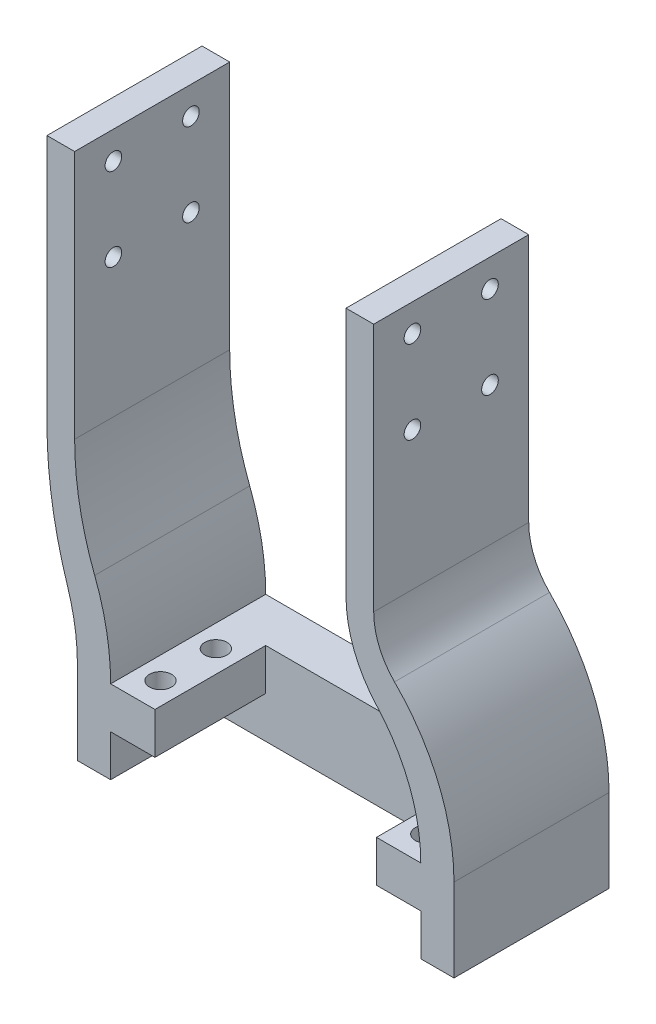
from build123d import *

# Parameters (mm, degrees)
SKETCH1_W           = 8
SKETCH1_H           = 8
SKETCH1_W_2         = 40
BOSS_EXTRUDE1_DEPTH = 15
SKETCH1_5_W         = 8
SKETCH1_5_H         = 20
SKETCH1_5_R         = 2
BOSS_EXTRUDE2_DEPTH = 7.5
BOSS_EXTRUDE3_DEPTH = 28
CUT_EXTRUDE1_REACH  = 105.271
SKETCH3_R           = 1.5


with BuildPart() as part:
    # Sketch1 → Boss-Extrude1 (new body)
    with BuildSketch(Plane(origin=(0, 0, 0), x_dir=(1, 0, 0), z_dir=(0, 1, 0))):
        Polygon((6, -28), (6, -8), (6, 0), (0, 0), (0, -28), align=None)
        with Locations((10, -4)):
            Rectangle(SKETCH1_W, SKETCH1_H)
        with Locations((34, -4)):
            Rectangle(SKETCH1_W_2, SKETCH1_H)
        with Locations((58, -4)):
            Rectangle(SKETCH1_W, SKETCH1_H)
        Polygon((62, 0), (62, -8), (62, -28), (68, -28), (68, 0), align=None)
    extrude(amount=-BOSS_EXTRUDE1_DEPTH)

    # Sketch1<5> → Boss-Extrude2 (add)
    # profile 1 of 2: a face of its own
    with BuildSketch(Plane(origin=(0, 0, 0), x_dir=(1, 0, 0), z_dir=(0, 1, 0))):
        with Locations((10, -18)):
            Rectangle(SKETCH1_5_W, SKETCH1_5_H)
        with Locations(Location((10, -23, 0), (0, 0, 270))):
            Circle(SKETCH1_5_R, mode=Mode.SUBTRACT)
        with Locations(Location((10, -13, 0), (0, 0, 270))):
            Circle(SKETCH1_5_R, mode=Mode.SUBTRACT)
    # profile 2 of 2: a face of its own
    with BuildSketch(Plane(origin=(0, 0, 0), x_dir=(1, 0, 0), z_dir=(0, 1, 0))):
        with Locations((58, -18)):
            Rectangle(SKETCH1_5_W, SKETCH1_5_H)
        with Locations(Location((58, -23, 0), (0, 0, 270))):
            Circle(SKETCH1_5_R, mode=Mode.SUBTRACT)
        with Locations(Location((58, -13, 0), (0, 0, 270))):
            Circle(SKETCH1_5_R, mode=Mode.SUBTRACT)
    extrude(amount=-BOSS_EXTRUDE2_DEPTH)

    # Sketch2 → Boss-Extrude3 (add)
    with BuildSketch(Plane.XY.offset(28)):
        with BuildLine():
            Line((-0.5, 80), (-5.5, 80))
            Line((-5.5, 80), (-5.5, 35))
            ThreePointArc((-5.5, 35), (-4.567837418, 23.063317904), (-1.793950653, 11.416049609))
            ThreePointArc((-1.793950653, 11.416049609), (-0.451222721, 5.778071643), (0, 0))
            Line((0, 0), (6, 0))
            ThreePointArc((6, 0), (5.273404236, 7.891775129), (3.118046932, 15.51820883))
            ThreePointArc((3.118046932, 15.51820883), (0.412179175, 25.092547618), (-0.5, 35))
            Line((-0.5, 35), (-0.5, 80))
        make_face()
        with BuildLine():
            Line((53.5, 80), (48.5, 80))
            Line((48.5, 80), (48.5, 35))
            ThreePointArc((48.5, 35), (49.937115956, 27.280735927), (54.055895054, 20.595827638))
            ThreePointArc((54.055895054, 20.595827638), (59.945137576, 11.037401409), (62, 0))
            Line((62, 0), (68, 0))
            ThreePointArc((68, 0), (65.207771721, 14.035220845), (57.256309947, 25.933044956))
            ThreePointArc((57.256309947, 25.933044956), (54.476245108, 30.092874105), (53.5, 35))
            Line((53.5, 35), (53.5, 80))
        make_face()
    extrude(amount=-BOSS_EXTRUDE3_DEPTH)

    # Cut-Extrude1: up to this face of the body (flat: up to its plane)
    cut_extrude1_end = Plane(part.part.faces().sort_by_distance((-5.5, 57.5, 14))[0])
    # Sketch3 → Cut-Extrude1 (cut, up to the picked face)
    with BuildSketch(Plane(origin=(53.5, 0, 0), x_dir=(0, 0, -1), z_dir=(1, 0, 0)), mode=Mode.PRIVATE) as cut_extrude1_sk1:
        with Locations(Location((-21, 75, 0), (0, 0, 90))):
            Circle(SKETCH3_R)
    cut_extrude1_tool1 = split(extrude(cut_extrude1_sk1.sketch, amount=-CUT_EXTRUDE1_REACH, mode=Mode.PRIVATE), bisect_by=cut_extrude1_end, keep=Keep.BOTH, mode=Mode.PRIVATE)
    # Sketch3 → Cut-Extrude1 (cut, up to the picked face)
    with BuildSketch(Plane(origin=(53.5, 0, 0), x_dir=(0, 0, -1), z_dir=(1, 0, 0)), mode=Mode.PRIVATE) as cut_extrude1_sk2:
        with Locations(Location((-21, 60, 0), (0, 0, 90))):
            Circle(SKETCH3_R)
    cut_extrude1_tool2 = split(extrude(cut_extrude1_sk2.sketch, amount=-CUT_EXTRUDE1_REACH, mode=Mode.PRIVATE), bisect_by=cut_extrude1_end, keep=Keep.BOTH, mode=Mode.PRIVATE)
    # Sketch3 → Cut-Extrude1 (cut, up to the picked face)
    with BuildSketch(Plane(origin=(53.5, 0, 0), x_dir=(0, 0, -1), z_dir=(1, 0, 0)), mode=Mode.PRIVATE) as cut_extrude1_sk3:
        with Locations(Location((-7, 60, 0), (0, 0, 180))):
            Circle(SKETCH3_R)
    cut_extrude1_tool3 = split(extrude(cut_extrude1_sk3.sketch, amount=-CUT_EXTRUDE1_REACH, mode=Mode.PRIVATE), bisect_by=cut_extrude1_end, keep=Keep.BOTH, mode=Mode.PRIVATE)
    # Sketch3 → Cut-Extrude1 (cut, up to the picked face)
    with BuildSketch(Plane(origin=(53.5, 0, 0), x_dir=(0, 0, -1), z_dir=(1, 0, 0)), mode=Mode.PRIVATE) as cut_extrude1_sk4:
        with Locations(Location((-7, 75, 0), (0, 0, 180))):
            Circle(SKETCH3_R)
    cut_extrude1_tool4 = split(extrude(cut_extrude1_sk4.sketch, amount=-CUT_EXTRUDE1_REACH, mode=Mode.PRIVATE), bisect_by=cut_extrude1_end, keep=Keep.BOTH, mode=Mode.PRIVATE)
    add(cut_extrude1_tool1.solids().sort_by(Axis((53.5, 75, 21), (-1, 0, 0)))[0], mode=Mode.SUBTRACT)
    add(cut_extrude1_tool2.solids().sort_by(Axis((53.5, 60, 21), (-1, 0, 0)))[0], mode=Mode.SUBTRACT)
    add(cut_extrude1_tool3.solids().sort_by(Axis((53.5, 60, 7), (-1, 0, 0)))[0], mode=Mode.SUBTRACT)
    add(cut_extrude1_tool4.solids().sort_by(Axis((53.5, 75, 7), (-1, 0, 0)))[0], mode=Mode.SUBTRACT)


solid = part.part
